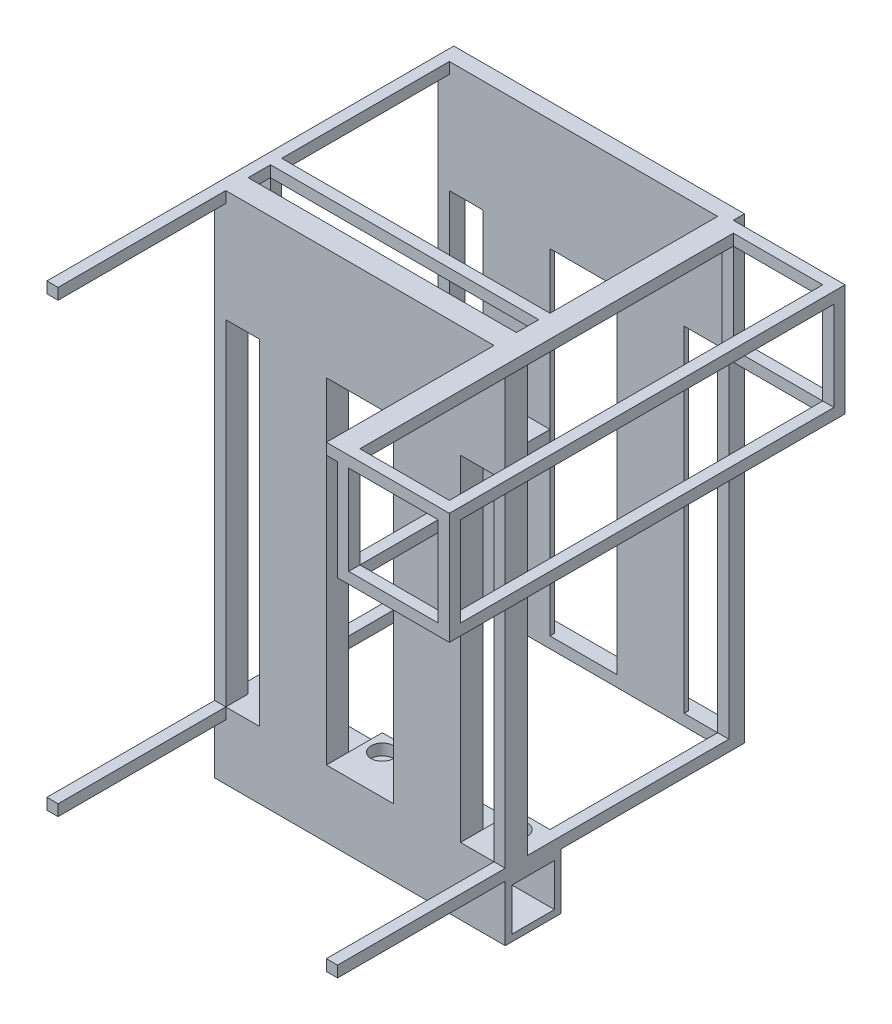
from build123d import *

# Parameters (mm, degrees)
SKETCH1_W                = 1300
SKETCH1_H                = 1600
SKETCH1_W_2              = 1200
SKETCH1_H_2              = 1500
BOSS_EXTRUDE1_DEPTH      = 100
SKETCH2_W                = 300
SKETCH2_H                = 100
BOSS_EXTRUDE2_DEPTH      = 1500
SKETCH3_W                = 150
SKETCH3_H                = 50
SKETCH3_W_2              = 295.855328594
SKETCH3_W_3              = 300
BOSS_EXTRUDE3_DEPTH      = 150
SKETCH4_R                = 50
CUT_EXTRUDE1_DEPTH       = 50
SKETCH5_W                = 100
SKETCH5_H                = 450
BOSS_EXTRUDE6_DEPTH      = 1300
BOSS_EXTRUDE7_DEPTH      = 750
BOSS_EXTRUDE7_DEPTH_BACK = 1000
SKETCH6_W                = 50
SKETCH6_H                = 50
SKETCH7_W                = 1300
SKETCH7_H                = 2050
BOSS_EXTRUDE8_DEPTH      = 20
SKETCH8_W                = 150
SKETCH8_H                = 1500
SKETCH8_W_2              = 300
CUT_EXTRUDE2_DEPTH       = 20
SKETCH9_W                = 50
SKETCH9_H                = 50
BOSS_EXTRUDE9_DEPTH      = 1958
SKETCH10_W               = 50
SKETCH10_H               = 50
BOSS_EXTRUDE10_DEPTH     = 1200
SKETCH11_W               = 500
SKETCH11_H               = 500
SKETCH11_W_2             = 400
SKETCH11_H_2             = 400
BOSS_EXTRUDE11_DEPTH     = 1770
SKETCH12_W               = 400
SKETCH12_H               = 1670
CUT_EXTRUDE3_DEPTH       = 500
SKETCH13_W               = 1670
SKETCH13_H               = 400
CUT_EXTRUDE5_DEPTH       = 500
SKETCH14_W               = 250
SKETCH14_H               = 250
SKETCH14_W_2             = 190
SKETCH14_H_2             = 190
BOSS_EXTRUDE12_DEPTH     = 1300
SKETCH15_W               = 1300
SKETCH15_H               = 2050
SKETCH15_W_2             = 1200
SKETCH15_H_2             = 1950
BOSS_EXTRUDE13_DEPTH     = 50
SKETCH16_W               = 50
SKETCH16_H               = 450
CUT_EXTRUDE6_DEPTH       = 50


with BuildPart() as part:
    # Sketch1 → Boss-Extrude1 (new body)
    with BuildSketch(Plane.XY):
        with Locations((650, -800)):
            Rectangle(SKETCH1_W, SKETCH1_H)
        with Locations((650, -800)):
            Rectangle(SKETCH1_W_2, SKETCH1_H_2, mode=Mode.SUBTRACT)
    extrude(amount=BOSS_EXTRUDE1_DEPTH)

    # Sketch2 → Boss-Extrude2 (add)
    with BuildSketch(Plane.XZ.offset(50)):
        with Locations((350, 50)):
            Rectangle(SKETCH2_W, SKETCH2_H)
        with Locations((950, 50)):
            Rectangle(SKETCH2_W, SKETCH2_H)
    extrude(amount=BOSS_EXTRUDE2_DEPTH)

    # Sketch3 → Boss-Extrude3 (add)
    with BuildSketch(Plane(origin=(0, 0, 0), x_dir=(-1, 0, 0), z_dir=(0, 0, -1))):
        with Locations((-1175, -25)):
            Rectangle(SKETCH3_W, SKETCH3_H)
        with Locations((-652.072335703, -25)):
            Rectangle(SKETCH3_W_2, SKETCH3_H)
        with Locations((-125, -25)):
            Rectangle(SKETCH3_W, SKETCH3_H)
        with Locations((-1175, -1575)):
            Rectangle(SKETCH3_W, SKETCH3_H)
        with Locations((-650, -1575)):
            Rectangle(SKETCH3_W_3, SKETCH3_H)
        with Locations((-125, -1575)):
            Rectangle(SKETCH3_W, SKETCH3_H)
    extrude(amount=BOSS_EXTRUDE3_DEPTH)

    # Sketch4 → Cut-Extrude1 (cut)
    with BuildSketch(Plane.XZ.offset(1600)):
        with Locations(Location((1175, -75, 0), (0, 0, 270))):
            Circle(SKETCH4_R)
        with Locations(Location((725, -75, 0), (0, 0, 270))):
            Circle(SKETCH4_R)
        with Locations(Location((575, -75, 0), (0, 0, 270))):
            Circle(SKETCH4_R)
        with Locations(Location((126.541195245, -75, 0), (0, 0, 270))):
            Circle(SKETCH4_R)
    extrude(amount=-CUT_EXTRUDE1_DEPTH, mode=Mode.SUBTRACT)

    # Sketch5 → Boss-Extrude6 (add)
    with BuildSketch(Plane.ZY):
        with Locations((50, 225)):
            Rectangle(SKETCH5_W, SKETCH5_H)
    extrude(amount=-BOSS_EXTRUDE6_DEPTH)

    # Sketch6 → Boss-Extrude7 (add, two sides: drawn at the far end of the back side and taken through both)
    with BuildSketch(Plane.XY.offset(100).offset(-BOSS_EXTRUDE7_DEPTH_BACK)):
        with Locations((25, 425)):
            Rectangle(SKETCH6_W, SKETCH6_H)
        with Locations((1275, 425)):
            Rectangle(SKETCH6_W, SKETCH6_H)
        with Locations((1275, -1575)):
            Rectangle(SKETCH6_W, SKETCH6_H)
        with Locations((25, -1575)):
            Rectangle(SKETCH6_W, SKETCH6_H)
    extrude(amount=BOSS_EXTRUDE7_DEPTH + BOSS_EXTRUDE7_DEPTH_BACK)

    # Sketch7 → Boss-Extrude8 (add)
    with BuildSketch(Plane(origin=(0, 0, -900), x_dir=(-1, 0, 0), z_dir=(0, 0, -1))):
        with Locations((-650, -575)):
            Rectangle(SKETCH7_W, SKETCH7_H)
    extrude(amount=BOSS_EXTRUDE8_DEPTH)

    # Sketch8 → Cut-Extrude2 (cut)
    with BuildSketch(Plane.XY.offset(-900)):
        with Locations((1175, -800)):
            Rectangle(SKETCH8_W, SKETCH8_H)
        with Locations((650, -800)):
            Rectangle(SKETCH8_W_2, SKETCH8_H)
        with Locations((125, -800)):
            Rectangle(SKETCH8_W, SKETCH8_H)
    extrude(amount=-CUT_EXTRUDE2_DEPTH, mode=Mode.SUBTRACT)

    # Sketch9 → Boss-Extrude9 (add)
    with BuildSketch(Plane.XZ.offset(-400)):
        with Locations((25, -125)):
            Rectangle(SKETCH9_W, SKETCH9_H)
    extrude(amount=BOSS_EXTRUDE9_DEPTH)

    # Sketch10 → Boss-Extrude10 (add)
    with BuildSketch(Plane.ZY.offset(-1250)):
        with Locations((-125, 425)):
            Rectangle(SKETCH10_W, SKETCH10_H)
    extrude(amount=BOSS_EXTRUDE10_DEPTH)

    # Sketch11 → Boss-Extrude11 (add)
    with BuildSketch(Plane(origin=(0, 0, -920), x_dir=(-1, 0, 0), z_dir=(0, 0, -1))):
        with Locations((-1550, 200)):
            Rectangle(SKETCH11_W, SKETCH11_H)
        with Locations((-1550, 200)):
            Rectangle(SKETCH11_W_2, SKETCH11_H_2, mode=Mode.SUBTRACT)
    extrude(amount=-BOSS_EXTRUDE11_DEPTH)

    # Sketch12 → Cut-Extrude3 (cut)
    with BuildSketch(Plane.XZ.offset(50)):
        with Locations((1550, -35)):
            Rectangle(SKETCH12_W, SKETCH12_H)
    extrude(amount=-CUT_EXTRUDE3_DEPTH, mode=Mode.SUBTRACT)

    # Sketch13 → Cut-Extrude5 (cut)
    with BuildSketch(Plane(origin=(1800, 0, 0), x_dir=(0, 0, -1), z_dir=(1, 0, 0))):
        with Locations((35, 200)):
            Rectangle(SKETCH13_W, SKETCH13_H)
    extrude(amount=-CUT_EXTRUDE5_DEPTH, mode=Mode.SUBTRACT)

    # Sketch14 → Boss-Extrude12 (add)
    with BuildSketch(Plane(origin=(1300, 0, 0), x_dir=(0, 0, -1), z_dir=(1, 0, 0))):
        with Locations((25, -1725)):
            Rectangle(SKETCH14_W, SKETCH14_H)
        with Locations((25, -1725)):
            Rectangle(SKETCH14_W_2, SKETCH14_H_2, mode=Mode.SUBTRACT)
    extrude(amount=-BOSS_EXTRUDE12_DEPTH)

    # Sketch15 → Boss-Extrude13 (add)
    with BuildSketch(Plane(origin=(0, 0, -920), x_dir=(-1, 0, 0), z_dir=(0, 0, -1))):
        with Locations((-650, -575)):
            Rectangle(SKETCH15_W, SKETCH15_H)
        with Locations((-650, -575)):
            Rectangle(SKETCH15_W_2, SKETCH15_H_2, mode=Mode.SUBTRACT)
    extrude(amount=BOSS_EXTRUDE13_DEPTH)

    # Sketch16 → Cut-Extrude6 (cut)
    with BuildSketch(Plane(origin=(1300, 0, 0), x_dir=(0, 0, -1), z_dir=(1, 0, 0))):
        with Locations((945, 175)):
            Rectangle(SKETCH16_W, SKETCH16_H)
    extrude(amount=-CUT_EXTRUDE6_DEPTH, mode=Mode.SUBTRACT)


solid = part.part
